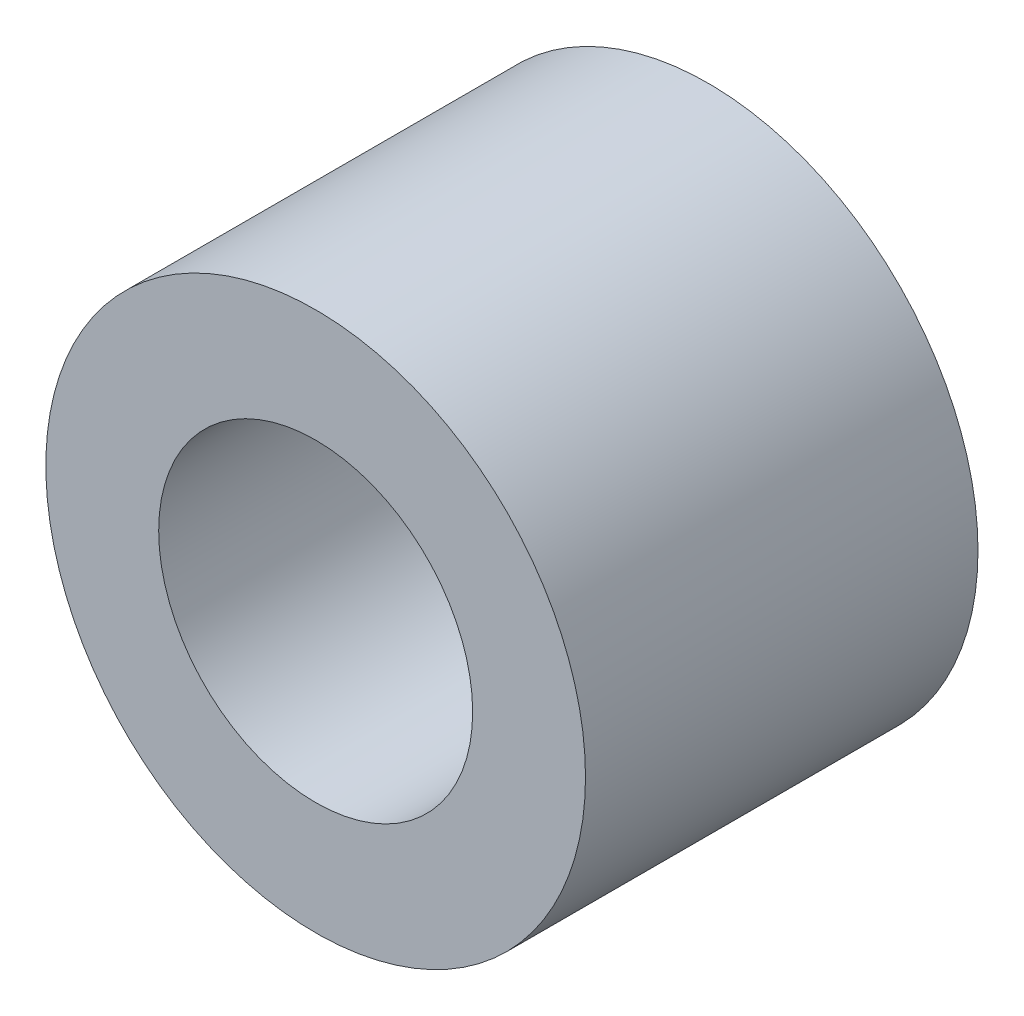
from build123d import *

# Parameters (mm, degrees)
SKETCH1_R           = 2.75
SKETCH1_R_2         = 1.6
BOSS_EXTRUDE1_DEPTH = 4


with BuildPart() as part:
    # Sketch1 → Boss-Extrude1 (new body)
    with BuildSketch(Plane.XY):
        Circle(SKETCH1_R)
        Circle(SKETCH1_R_2, mode=Mode.SUBTRACT)
    extrude(amount=BOSS_EXTRUDE1_DEPTH)


solid = part.part
